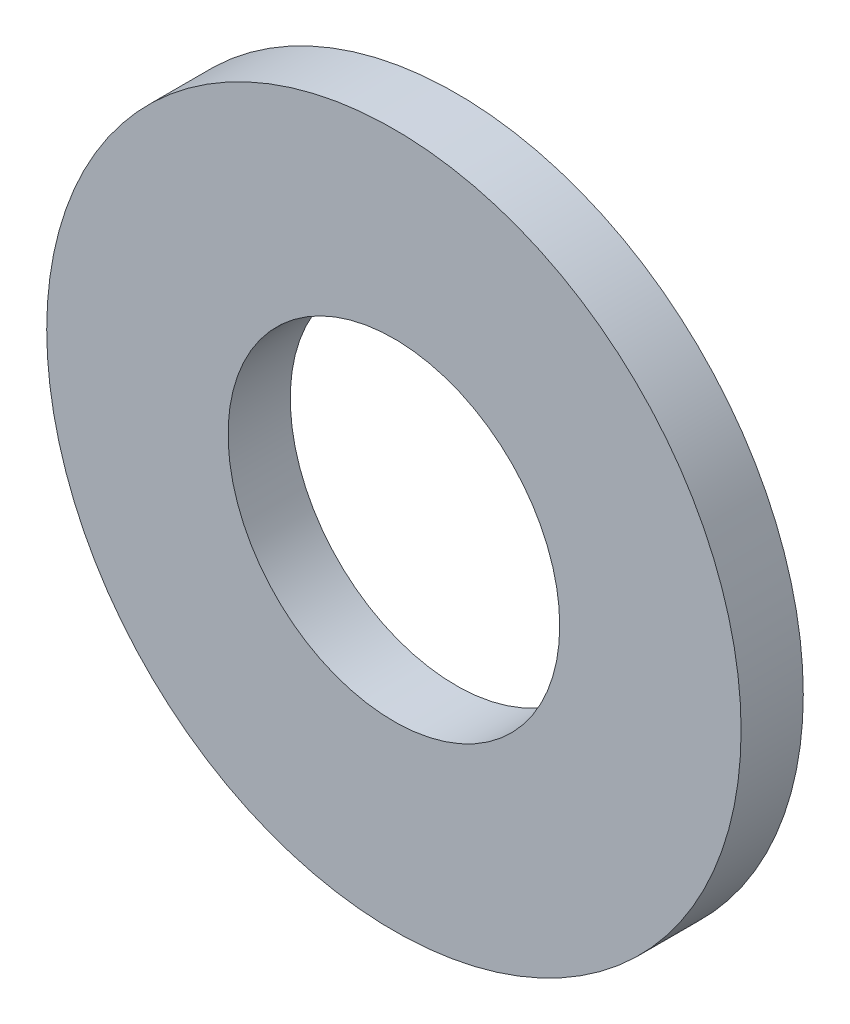
from build123d import *

# Parameters (mm, degrees)
SKETCH1_R           = 3.35
SKETCH1_R_2         = 1.6
BOSS_EXTRUDE1_DEPTH = 0.6


with BuildPart() as part:
    # Sketch1 → Boss-Extrude1 (new body)
    with BuildSketch(Plane.XY):
        Circle(SKETCH1_R)
        Circle(SKETCH1_R_2, mode=Mode.SUBTRACT)
    extrude(amount=BOSS_EXTRUDE1_DEPTH)


solid = part.part
